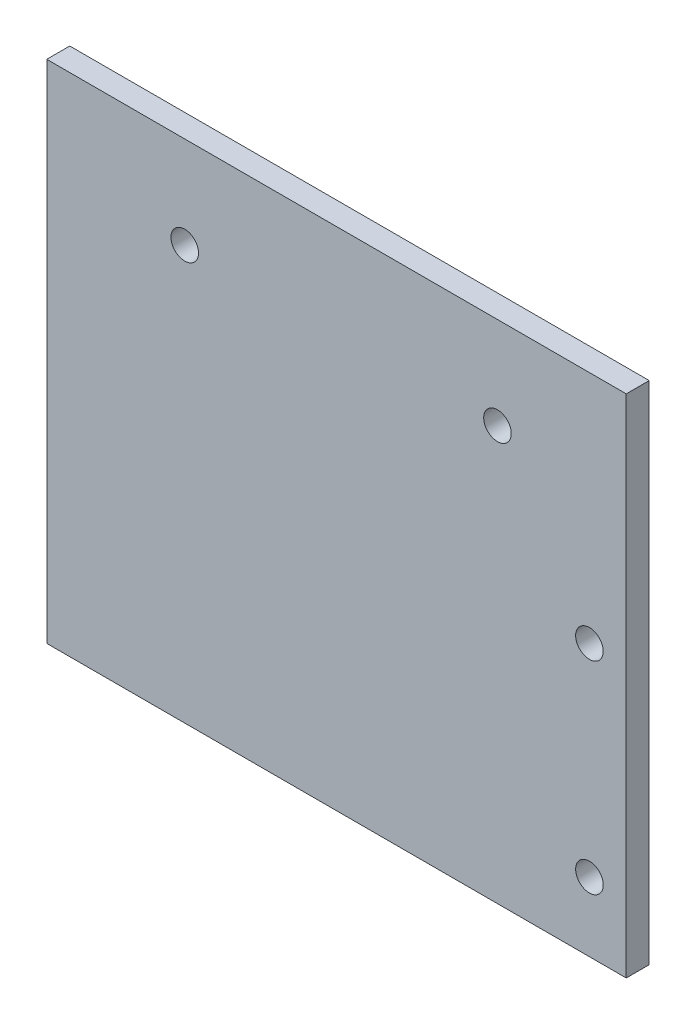
from build123d import *

# Parameters (mm, degrees)
SKETCH1_W           = 163
SKETCH1_H           = 150
BOSS_EXTRUDE1_DEPTH = 2.5
SKETCH3_R           = 1.5
CUT_EXTRUDE1_DEPTH  = 2.5
SKETCH4_W           = 4
SKETCH4_H           = 22
CUT_EXTRUDE2_DEPTH  = 111.785829419
SKETCH5_R           = 1.1
CUT_EXTRUDE3_DEPTH  = 111.785829419
CUT_EXTRUDE4_START  = -10
SKETCH6_W           = 4
SKETCH6_H           = 22
SKETCH6_R           = 1.5
SKETCH6_R_2         = 1.1
CUT_EXTRUDE4_DEPTH  = 10


with BuildPart() as part:
    # Sketch1 → Boss-Extrude1 (new body)
    with BuildSketch(Plane.XY):
        Rectangle(SKETCH1_W, SKETCH1_H)
    extrude(amount=BOSS_EXTRUDE1_DEPTH)

    # Sketch3 → Cut-Extrude1 (cut)
    with BuildSketch(Plane.XY.offset(2.5)):
        with Locations((-67.5, -30)):
            Circle(SKETCH3_R)
        with Locations((-33.5, -30)):
            Circle(SKETCH3_R)
        with Locations((-77.5, -45.5)):
            Circle(SKETCH3_R)
        with Locations((-77.5, -67.5)):
            Circle(SKETCH3_R)
    cut_extrude1 = extrude(amount=-CUT_EXTRUDE1_DEPTH, mode=Mode.SUBTRACT)

    # Mirror1: Cut-Extrude1 across plane
    add(cut_extrude1.mirror(Plane(origin=(0, 0, 0), x_dir=(0, 0, 1), z_dir=(1, 0, 0))), mode=Mode.SUBTRACT)

    # Sketch4 → Cut-Extrude2 (cut, through all)
    with BuildSketch(Plane.XY.offset(2.5)):
        with Locations((32.5, -7.5)):
            Rectangle(SKETCH4_W, SKETCH4_H)
        with Locations((-32.5, 27.5)):
            Rectangle(SKETCH4_W, SKETCH4_H)
        with Locations((-32.5, -7.5)):
            Rectangle(SKETCH4_W, SKETCH4_H)
        with Locations((32.5, 27.5)):
            Rectangle(SKETCH4_W, SKETCH4_H)
    extrude(amount=-CUT_EXTRUDE2_DEPTH, mode=Mode.SUBTRACT)

    # Sketch5 → Cut-Extrude3 (cut, through all)
    with BuildSketch(Plane.XY.offset(2.5)):
        with Locations((-28, 70)):
            Circle(SKETCH5_R)
        with Locations((28, 70)):
            Circle(SKETCH5_R)
    extrude(amount=-CUT_EXTRUDE3_DEPTH, mode=Mode.SUBTRACT)

    # Sketch6 → Cut-Extrude4 (cut)
    with BuildSketch(Plane(origin=(0, 0, 0), x_dir=(-1, 0, 0), z_dir=(0, 0, -1)).offset(CUT_EXTRUDE4_START)):
        Polygon((-18.5, -20), (-18.5, -75), (81.5, -75), (81.5, 75), (-81.5, 75), (-81.5, -20), align=None)
        with Locations((-32.5, -7.5)):
            Rectangle(SKETCH6_W, SKETCH6_H, mode=Mode.SUBTRACT)
        with Locations((77.5, -67.5)):
            Circle(SKETCH6_R, mode=Mode.SUBTRACT)
        with Locations((77.5, -45.5)):
            Circle(SKETCH6_R, mode=Mode.SUBTRACT)
        with Locations((33.5, -30)):
            Circle(SKETCH6_R, mode=Mode.SUBTRACT)
        with Locations((32.5, -7.5)):
            Rectangle(SKETCH6_W, SKETCH6_H, mode=Mode.SUBTRACT)
        with Locations((67.5, -30)):
            Circle(SKETCH6_R, mode=Mode.SUBTRACT)
        with Locations((-32.5, 27.5)):
            Rectangle(SKETCH6_W, SKETCH6_H, mode=Mode.SUBTRACT)
        with Locations((-28, 70)):
            Circle(SKETCH6_R_2, mode=Mode.SUBTRACT)
        with Locations((32.5, 27.5)):
            Rectangle(SKETCH6_W, SKETCH6_H, mode=Mode.SUBTRACT)
        with Locations((28, 70)):
            Circle(SKETCH6_R_2, mode=Mode.SUBTRACT)
    extrude(amount=CUT_EXTRUDE4_DEPTH, mode=Mode.SUBTRACT)


solid = part.part
